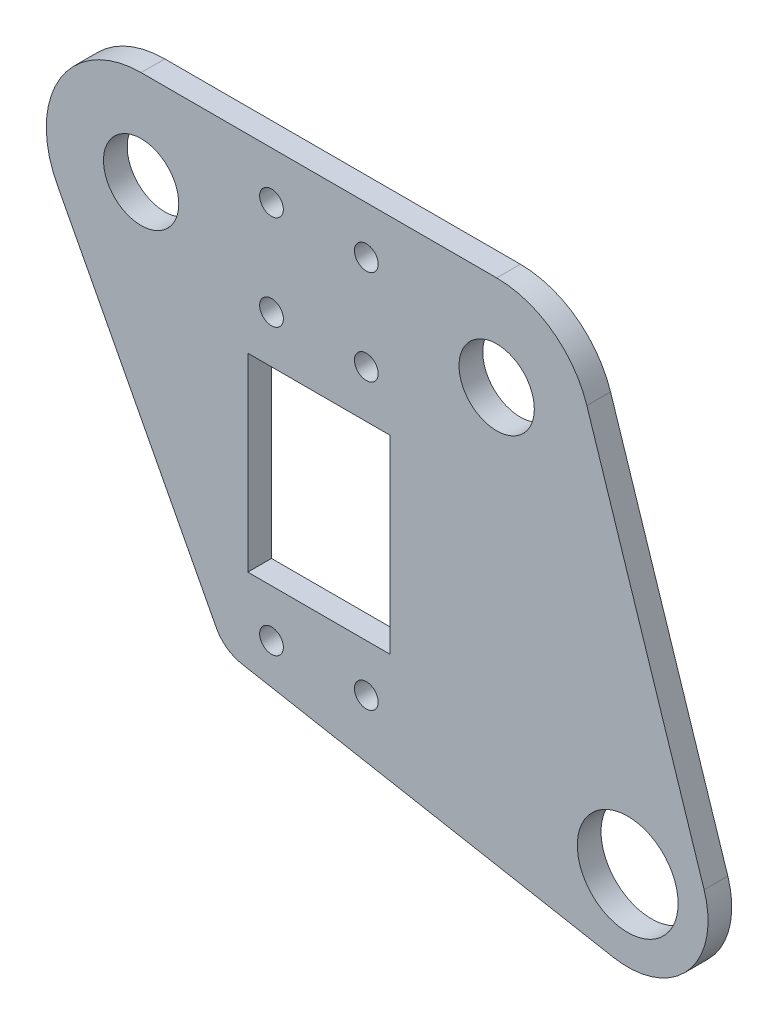
from build123d import *

# Parameters (mm, degrees)
SKETCH1_W                    = 19.05
SKETCH1_H                    = 25.4
BOSS_EXTRUDE1_DEPTH          = 3.175
F_3_8_CLEARANCE_HOLE1_D      = 10.0838
M12_CLEARANCE_HOLE1_D        = 13.5
F_1_8_0_125_DIAMETER_HOLE1_D = 3.175


with BuildPart() as part:
    # Sketch1 → Boss-Extrude1 (new body)
    with BuildSketch(Plane.XY):
        with BuildLine():
            Line((-23.8125, 12.7), (23.8125, 12.7))
            ThreePointArc((23.8125, 12.7), (31.276314181, 10.275284807), (35.890108891, 3.927004389))
            Line((35.890108891, 3.927004389), (51.598960291, -44.38599569))
            ThreePointArc((51.598960291, -44.38599569), (49.460825767, -54.804118571), (39.416075709, -58.298671456))
            Line((39.416075709, -58.298671456), (-10.386929216, -49.133853571))
            ThreePointArc((-10.386929216, -49.133853571), (-12.351826078, -48.282813663), (-13.745274772, -46.65696332))
            Line((-13.745274772, -46.65696332), (-35.06656606, -5.885235519))
            ThreePointArc((-35.06656606, -5.885235519), (-34.676028227, 6.578278989), (-23.8125, 12.7))
        make_face()
        with Locations((0, -25.4)):
            Rectangle(SKETCH1_W, SKETCH1_H, mode=Mode.SUBTRACT)
    extrude(amount=BOSS_EXTRUDE1_DEPTH)

    # 3/8 Clearance Hole1 (through all)
    with Locations(Plane.XY.offset(3.175)):
        with Locations((-23.8125, 0), (23.8125, 0)):
            Hole(F_3_8_CLEARANCE_HOLE1_D / 2)

    # M12 Clearance Hole1 (through all)
    with Locations(Plane.XY.offset(3.175)):
        with Locations((41.3639, -47.7139)):
            Hole(M12_CLEARANCE_HOLE1_D / 2)

    # 1/8 (0.125) Diameter Hole1 (through all)
    with Locations(Plane.XY.offset(3.175)):
        with Locations((6.35, -6.35), (-6.35, 6.35), (-6.35, -6.35), (6.35, 6.35), (-6.35, -44.45), (6.35, -44.45)):
            Hole(F_1_8_0_125_DIAMETER_HOLE1_D / 2)


solid = part.part
